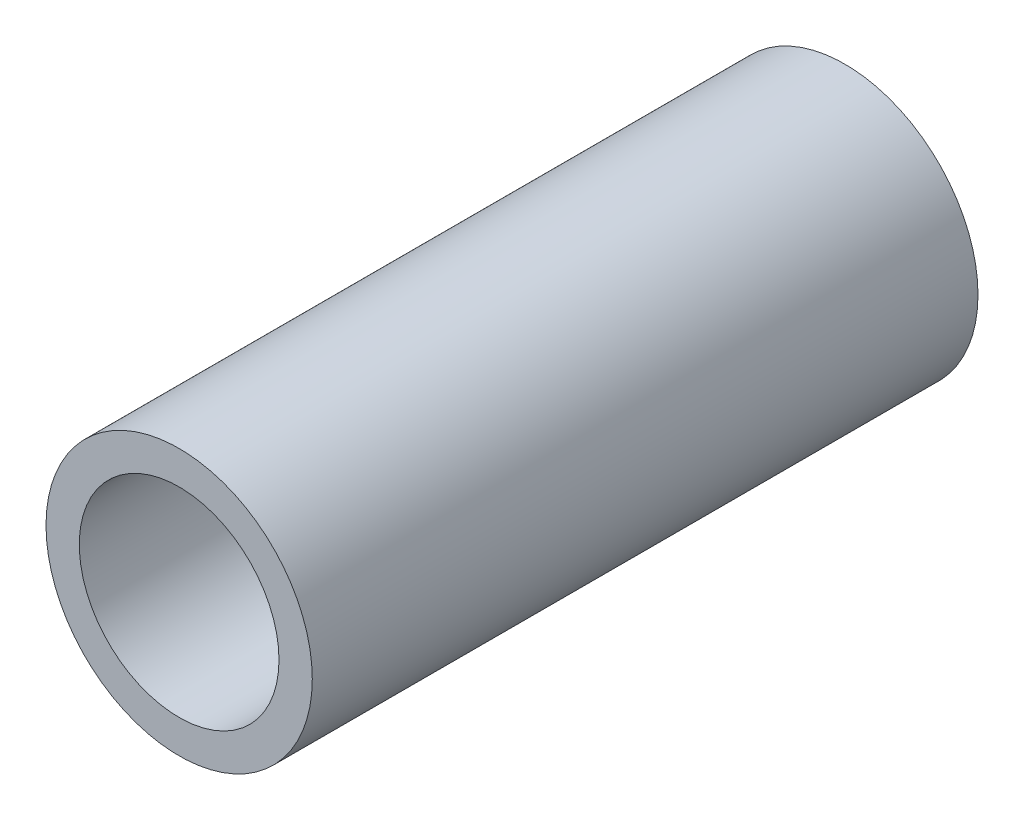
from build123d import *

# Parameters (mm, degrees)
CROQUIS1_R            = 12.7
CROQUIS1_R_2          = 9.525
EXTRUIR_L_MINA1_DEPTH = 31.75


with BuildPart() as part:
    # Croquis1 → Extruir-Lámina1 (new, symmetric)
    with BuildSketch(Plane.XY):
        Circle(CROQUIS1_R)
        Circle(CROQUIS1_R_2, mode=Mode.SUBTRACT)
    extrude(amount=EXTRUIR_L_MINA1_DEPTH, both=True)


solid = part.part
